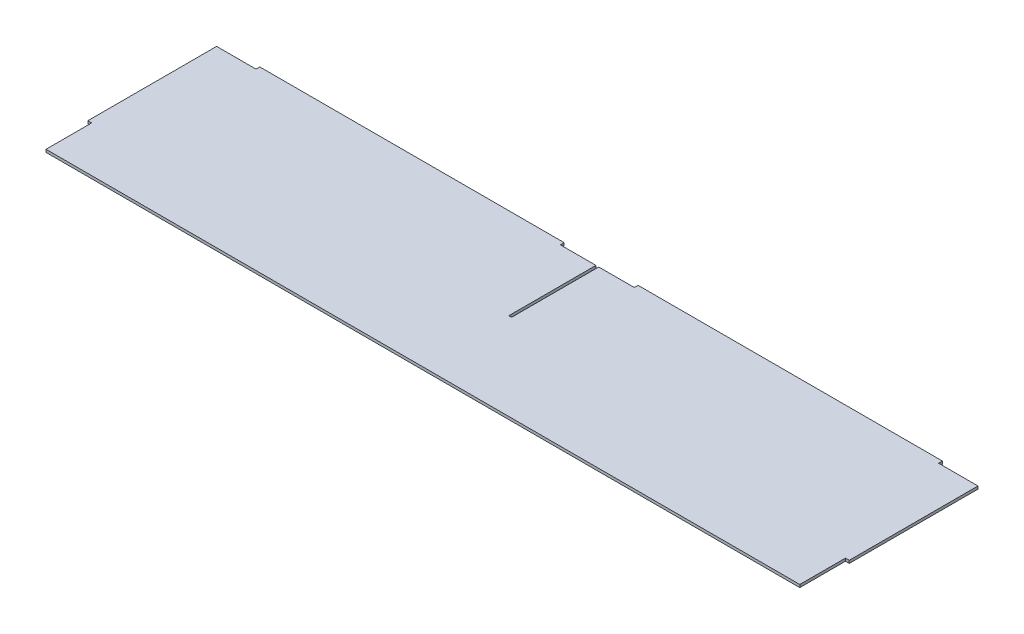
from build123d import *

# Parameters (mm, degrees)
SKETCH1_W           = 635.3556
SKETCH1_H           = 145.542
BOSS_EXTRUDE1_DEPTH = 1.143
BOSS_EXTRUDE2_DEPTH = 3.175
SKETCH3_W           = 3.175
SKETCH3_H           = 38.1
CUT_EXTRUDE1_DEPTH  = 327.637727957
SKETCH4_W           = 2.3368
SKETCH4_H           = 72.771
CUT_EXTRUDE2_DEPTH  = 327.637727957


with BuildPart() as part:
    # Sketch1 → Boss-Extrude1 (new, symmetric)
    with BuildSketch(Plane(origin=(0, 0, 0), x_dir=(1, 0, 0), z_dir=(0, 1, 0))):
        Rectangle(SKETCH1_W, SKETCH1_H)
    extrude(amount=BOSS_EXTRUDE1_DEPTH, both=True)

    # Sketch2 → Boss-Extrude2 (add)
    with BuildSketch(Plane(origin=(0, 0, -72.771), x_dir=(-1, 0, 0), z_dir=(0, 0, -1))):
        Polygon((-284.8269005, -1.143), (-30.826511563, -1.143), (-30.822511063, 1.143), (-284.8229, 1.143), align=None)
        Polygon((30.8188995, -1.143), (284.819288437, -1.143), (284.823288937, 1.143), (30.8229, 1.143), align=None)
    extrude(amount=BOSS_EXTRUDE2_DEPTH)

    # Sketch3 → Cut-Extrude1 (cut, through all)
    with BuildSketch(Plane.XZ.offset(1.143)):
        with Locations((-316.0903, 53.721)):
            Rectangle(SKETCH3_W, SKETCH3_H)
    cut_extrude1 = extrude(amount=-CUT_EXTRUDE1_DEPTH, mode=Mode.SUBTRACT)

    # Mirror1: Cut-Extrude1 across plane
    add(cut_extrude1.mirror(Plane(origin=(0, 0, 0), x_dir=(0, 0, 1), z_dir=(1, 0, 0))), mode=Mode.SUBTRACT)

    # Sketch4 → Cut-Extrude2 (cut, through all)
    with BuildSketch(Plane.XZ.offset(1.143)):
        with Locations((0.0254, -36.3855)):
            Rectangle(SKETCH4_W, SKETCH4_H)
    extrude(amount=-CUT_EXTRUDE2_DEPTH, mode=Mode.SUBTRACT)


solid = part.part
